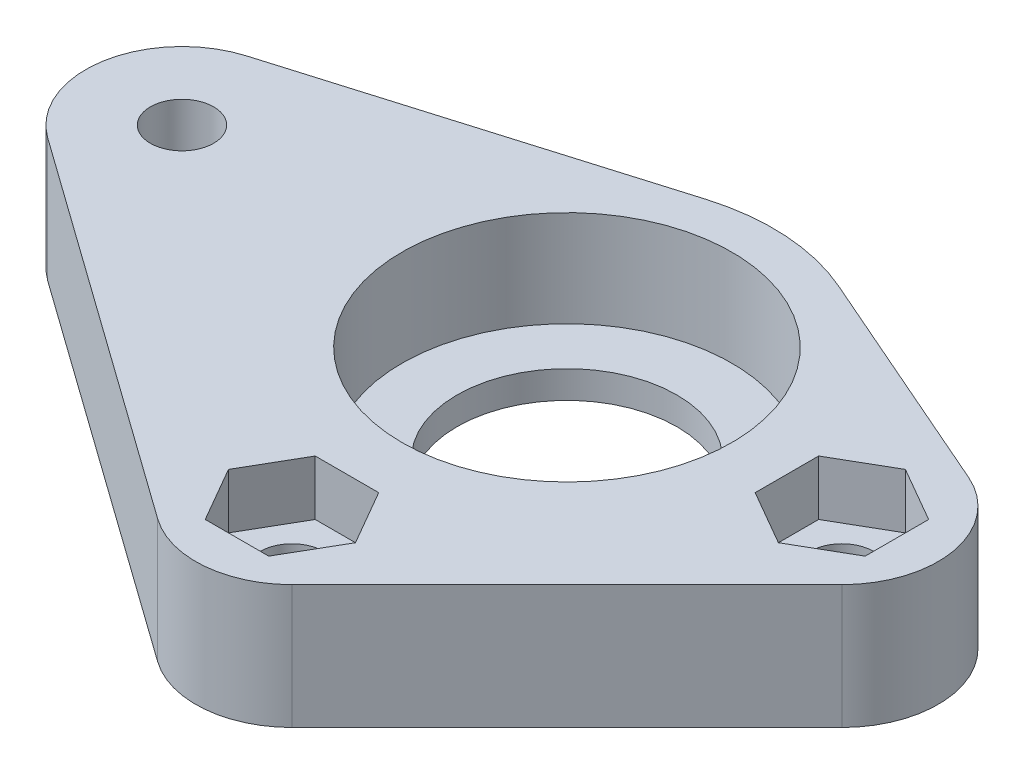
from build123d import *

# Parameters (mm, degrees)
SKETCH1_R           = 4
SKETCH1_R_2         = 1.15
BOSS_EXTRUDE1_DEPTH = 4.5
SKETCH2_R           = 6
CUT_EXTRUDE1_DEPTH  = 3.5
CUT_EXTRUDE2_DEPTH  = 2
CUT_EXTRUDE3_DEPTH  = 2


with BuildPart() as part:
    # Sketch1 → Boss-Extrude1 (new body)
    with BuildSketch(Plane(origin=(0, 0, 0), x_dir=(1, 0, 0), z_dir=(0, 1, 0))):
        with BuildLine():
            Line((3, 6.873863542), (11.4, 3.207802986))
            ThreePointArc((11.4, 3.207802986), (13.439020979, 0.650488054), (12.474873734, -2.474873734))
            Line((12.474873734, -2.474873734), (2.474873734, -12.474873734))
            ThreePointArc((2.474873734, -12.474873734), (0.28868186, -13.488074366), (-2.034333678, -12.848067149))
            Line((-2.034333678, -12.848067149), (-16.034333678, -2.848067149))
            ThreePointArc((-16.034333678, -2.848067149), (-17.452321053, 0.575742432), (-15, 3.354101966))
            Line((-15, 3.354101966), (-2.142857143, 7.187361356))
            ThreePointArc((-2.142857143, 7.187361356), (0.456337254, 7.486104215), (3, 6.873863542))
        make_face()
        with Locations(Location((0, 0, 0), (0, 0, 270))):
            Circle(SKETCH1_R, mode=Mode.SUBTRACT)
        with Locations(Location((-14, 0, 0), (0, 0, 270))):
            Circle(SKETCH1_R_2, mode=Mode.SUBTRACT)
        with Locations(Location((10, 0, 0), (0, 0, 270))):
            Circle(SKETCH1_R_2, mode=Mode.SUBTRACT)
        with Locations(Location((0, -10, 0), (0, 0, 270))):
            Circle(SKETCH1_R_2, mode=Mode.SUBTRACT)
    extrude(amount=BOSS_EXTRUDE1_DEPTH)

    # Sketch2 → Cut-Extrude1 (cut)
    with BuildSketch(Plane(origin=(0, 4.5, 0), x_dir=(1, 0, 0), z_dir=(0, 1, 0))):
        with Locations(Location((0, 0, 0), (0, 0, 270))):
            Circle(SKETCH2_R)
    extrude(amount=-CUT_EXTRUDE1_DEPTH, mode=Mode.SUBTRACT)

    # Sketch3 → Cut-Extrude2 (cut)
    with BuildSketch(Plane(origin=(0, 4.5, 0), x_dir=(1, 0, 0), z_dir=(0, 1, 0))):
        Polygon((12, -1.154700538), (12, 1.154700538), (10, 2.309401077), (8, 1.154700538), (8, -1.154700538), (10, -2.309401077), align=None)
        Polygon((2.309401077, -10), (1.154700538, -8), (-1.154700538, -8), (-2.309401077, -10), (-1.154700538, -12), (1.154700538, -12), align=None)
    extrude(amount=-CUT_EXTRUDE2_DEPTH, mode=Mode.SUBTRACT)

    # Sketch4 → Cut-Extrude3 (cut)
    with BuildSketch(Plane.XZ):
        Polygon((-12, -1.154700538), (-12, 1.154700538), (-14, 2.309401077), (-16, 1.154700538), (-16, -1.154700538), (-14, -2.309401077), align=None)
    extrude(amount=-CUT_EXTRUDE3_DEPTH, mode=Mode.SUBTRACT)


solid = part.part
